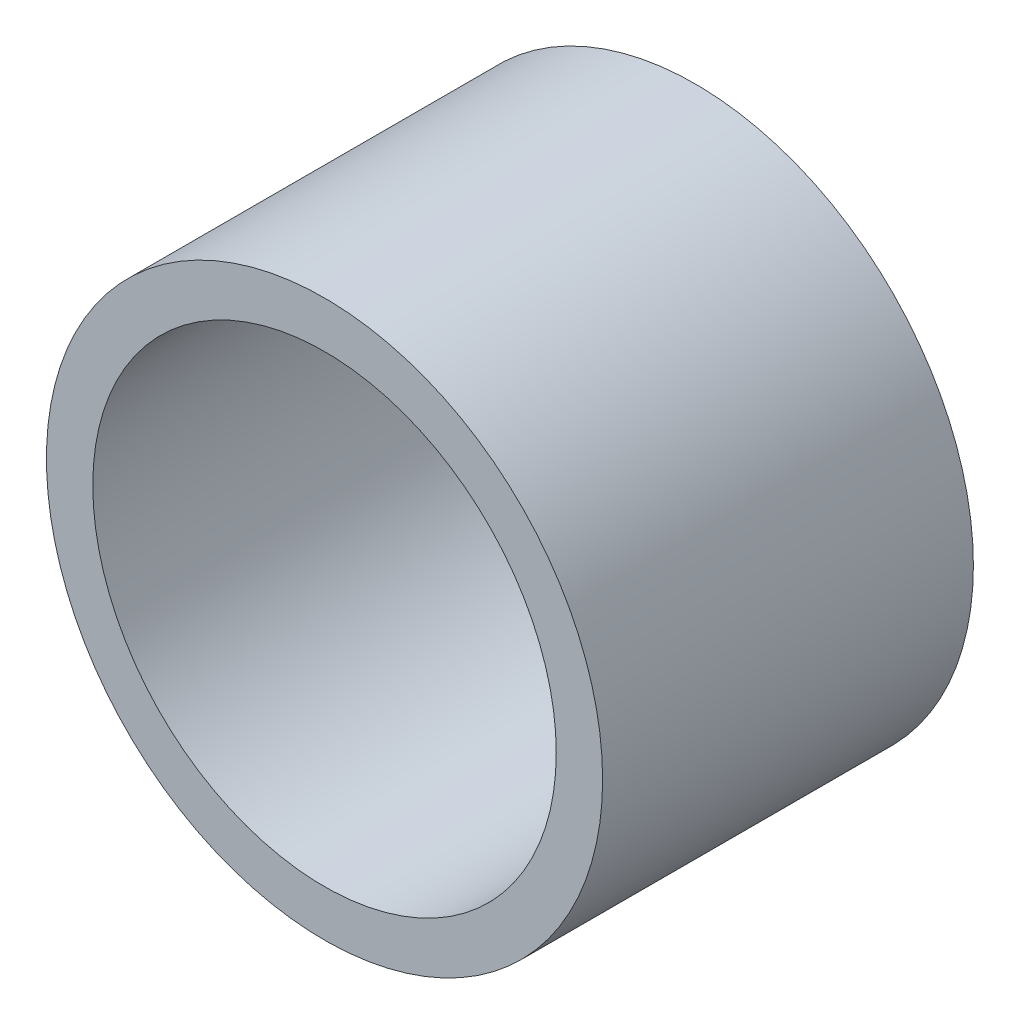
from build123d import *

# Parameters (mm, degrees)
CROQUIS1_R              = 15
CROQUIS1_R_2            = 12.5
SALIENTE_EXTRUIR1_DEPTH = 20


with BuildPart() as part:
    # Croquis1 → Saliente-Extruir1 (new body)
    with BuildSketch(Plane.XY):
        Circle(CROQUIS1_R)
        Circle(CROQUIS1_R_2, mode=Mode.SUBTRACT)
    extrude(amount=-SALIENTE_EXTRUIR1_DEPTH)


solid = part.part
